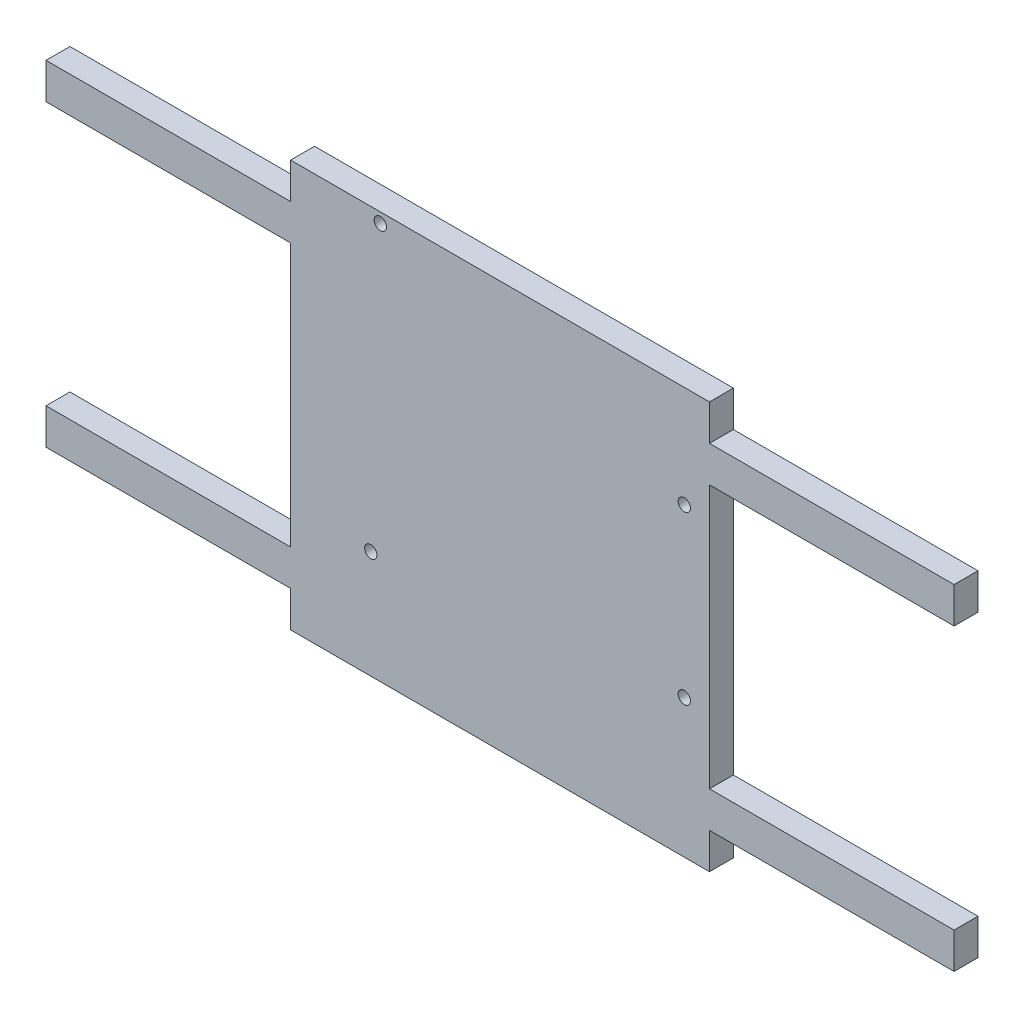
from build123d import *

# Parameters (mm, degrees)
SKETCH1_W           = 70
SKETCH1_H           = 68
SKETCH1_R           = 1.0287
BOSS_EXTRUDE1_DEPTH = 4
SKETCH2_W           = 40.88
SKETCH2_H           = 6
BOSS_EXTRUDE2_DEPTH = 4


with BuildPart() as part:
    # Sketch1 → Boss-Extrude1 (new body)
    with BuildSketch(Plane.XY):
        Rectangle(SKETCH1_W, SKETCH1_H)
        with Locations((-21.606472839, -15.978304245)):
            Circle(SKETCH1_R, mode=Mode.SUBTRACT)
        with Locations((30.793527161, -10.878304245)):
            Circle(SKETCH1_R, mode=Mode.SUBTRACT)
        with Locations((30.793527161, 17.021695755)):
            Circle(SKETCH1_R, mode=Mode.SUBTRACT)
        with Locations((-20.006472839, 32.321695755)):
            Circle(SKETCH1_R, mode=Mode.SUBTRACT)
    extrude(amount=BOSS_EXTRUDE1_DEPTH)

    # Sketch2 → Boss-Extrude2 (add)
    with BuildSketch(Plane(origin=(0, 0, 0), x_dir=(-1, 0, 0), z_dir=(0, 0, -1))):
        with Locations((55.44, 25)):
            Rectangle(SKETCH2_W, SKETCH2_H)
        with Locations((-55.44, 25)):
            Rectangle(SKETCH2_W, SKETCH2_H)
        with Locations((-55.44, -25)):
            Rectangle(SKETCH2_W, SKETCH2_H)
        with Locations((55.44, -25)):
            Rectangle(SKETCH2_W, SKETCH2_H)
    extrude(amount=-BOSS_EXTRUDE2_DEPTH)


solid = part.part
